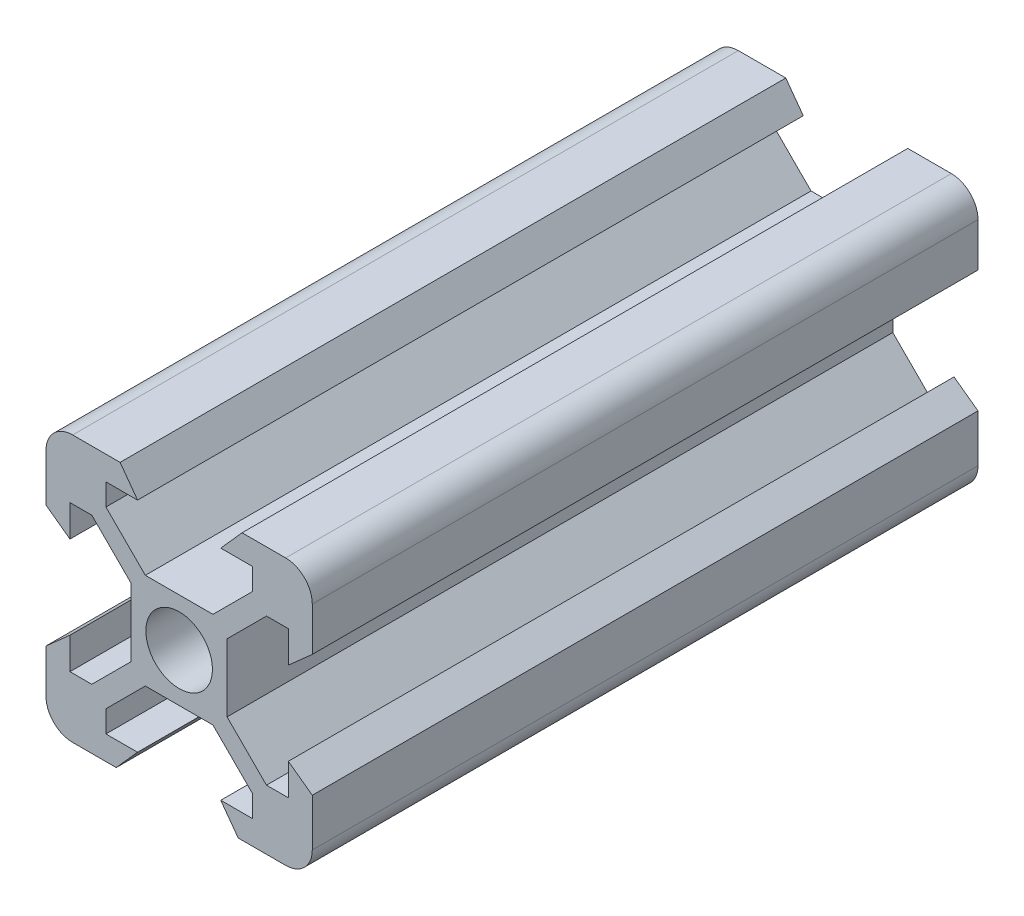
from build123d import *

# Parameters (mm, degrees)
SKETCH1_R           = 2.5
BOSS_EXTRUDE1_DEPTH = 50


with BuildPart() as part:
    # Sketch1 → Boss-Extrude1 (new body)
    with BuildSketch(Plane.XY):
        with BuildLine():
            Line((-4.725542729, -10), (-3.125, -8.2))
            Line((-3.125, -8.2), (-5.5, -8.2))
            Line((-5.5, -8.2), (-5.5, -6.560660172))
            Line((-5.5, -6.560660172), (-2.539339828, -3.6))
            Line((-2.539339828, -3.6), (2.539339828, -3.6))
            Line((2.539339828, -3.6), (5.5, -6.560660172))
            Line((5.5, -6.560660172), (5.5, -8.2))
            Line((5.5, -8.2), (3.125, -8.2))
            Line((3.125, -8.2), (4.434457271, -10))
            Line((4.434457271, -10), (8, -10))
            ThreePointArc((8, -10), (9.414213562, -9.414213562), (10, -8))
            Line((10, -8), (10, -4.434457271))
            Line((10, -4.434457271), (8.2, -3.125))
            Line((8.2, -3.125), (8.2, -5.5))
            Line((8.2, -5.5), (6.560660172, -5.5))
            Line((6.560660172, -5.5), (3.6, -2.539339828))
            Line((3.6, -2.539339828), (3.6, 2.539339828))
            Line((3.6, 2.539339828), (6.560660172, 5.5))
            Line((6.560660172, 5.5), (8.2, 5.5))
            Line((8.2, 5.5), (8.2, 3.125))
            Line((8.2, 3.125), (10, 4.725542729))
            Line((10, 4.725542729), (10, 8))
            ThreePointArc((10, 8), (9.414213562, 9.414213562), (8, 10))
            Line((8, 10), (4.725542729, 10))
            Line((4.725542729, 10), (3.125, 8.2))
            Line((3.125, 8.2), (5.5, 8.2))
            Line((5.5, 8.2), (5.5, 6.560660172))
            Line((5.5, 6.560660172), (2.539339828, 3.6))
            Line((2.539339828, 3.6), (-2.539339828, 3.6))
            Line((-2.539339828, 3.6), (-5.5, 6.560660172))
            Line((-5.5, 6.560660172), (-5.5, 8.2))
            Line((-5.5, 8.2), (-3.125, 8.2))
            Line((-3.125, 8.2), (-4.434457271, 10))
            Line((-4.434457271, 10), (-8, 10))
            ThreePointArc((-8, 10), (-9.414213562, 9.414213562), (-10, 8))
            Line((-10, 8), (-10, 4.434457271))
            Line((-10, 4.434457271), (-8.2, 3.125))
            Line((-8.2, 3.125), (-8.2, 5.5))
            Line((-8.2, 5.5), (-6.560660172, 5.5))
            Line((-6.560660172, 5.5), (-3.6, 2.539339828))
            Line((-3.6, 2.539339828), (-3.6, -2.539339828))
            Line((-3.6, -2.539339828), (-6.560660172, -5.5))
            Line((-6.560660172, -5.5), (-8.2, -5.5))
            Line((-8.2, -5.5), (-8.2, -3.125))
            Line((-8.2, -3.125), (-10, -4.725542729))
            Line((-10, -4.725542729), (-10, -8))
            ThreePointArc((-10, -8), (-9.414213562, -9.414213562), (-8, -10))
            Line((-8, -10), (-4.725542729, -10))
        make_face()
        Circle(SKETCH1_R, mode=Mode.SUBTRACT)
    extrude(amount=BOSS_EXTRUDE1_DEPTH)


solid = part.part
